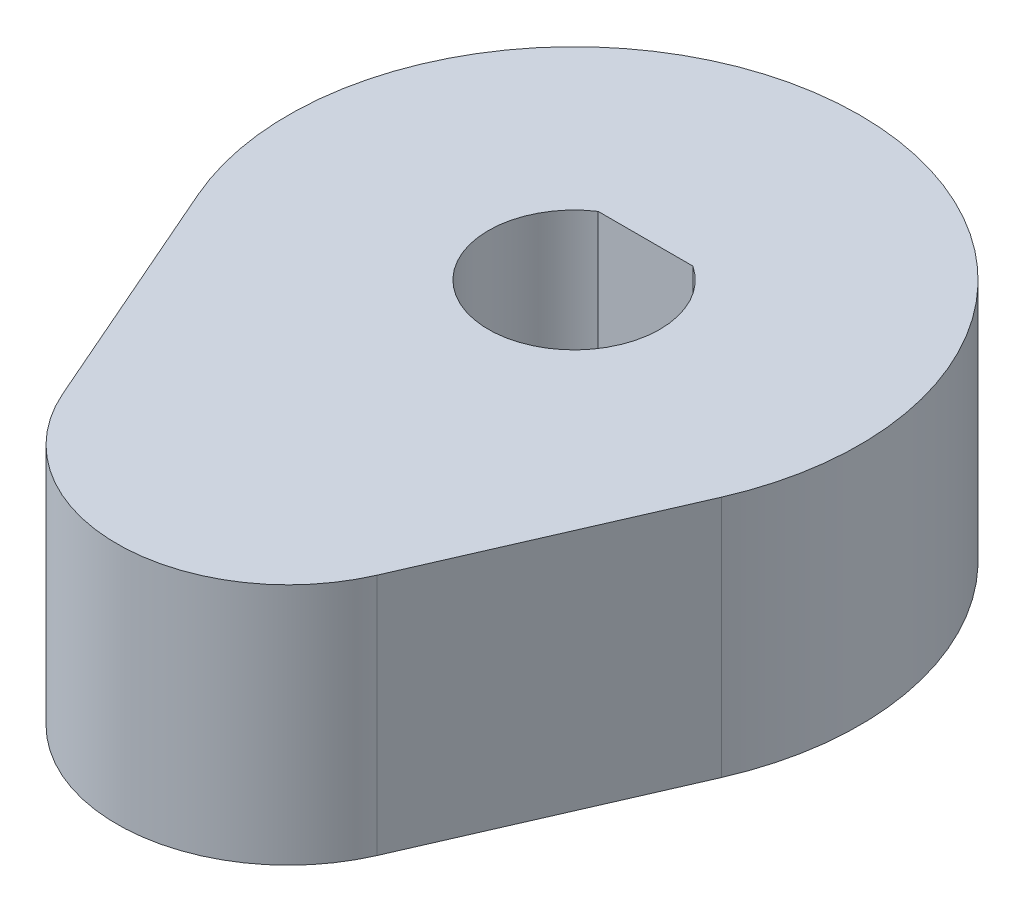
from build123d import *

# Parameters (mm, degrees)
BOSS_EXTRUDE1_DEPTH = 8.5


with BuildPart() as part:
    # Sketch1 → Boss-Extrude1 (new body)
    with BuildSketch(Plane(origin=(0, 0, 0), x_dir=(1, 0, 0), z_dir=(0, 1, 0))):
        with BuildLine():
            Line((-9.16515139, -4), (-5.499090834, -12.4))
            ThreePointArc((-5.499090834, -12.4), (0, -16), (5.499090834, -12.4))
            Line((5.499090834, -12.4), (9.16515139, -4))
            ThreePointArc((9.16515139, -4), (0, 10), (-9.16515139, -4))
        make_face()
        with BuildLine():
            Line((1.658301541, 2.5), (-1.658301541, 2.5))
            ThreePointArc((-1.658301541, 2.5), (0, -2.999994), (1.658301541, 2.5))
        make_face(mode=Mode.SUBTRACT)
    extrude(amount=BOSS_EXTRUDE1_DEPTH)


solid = part.part
